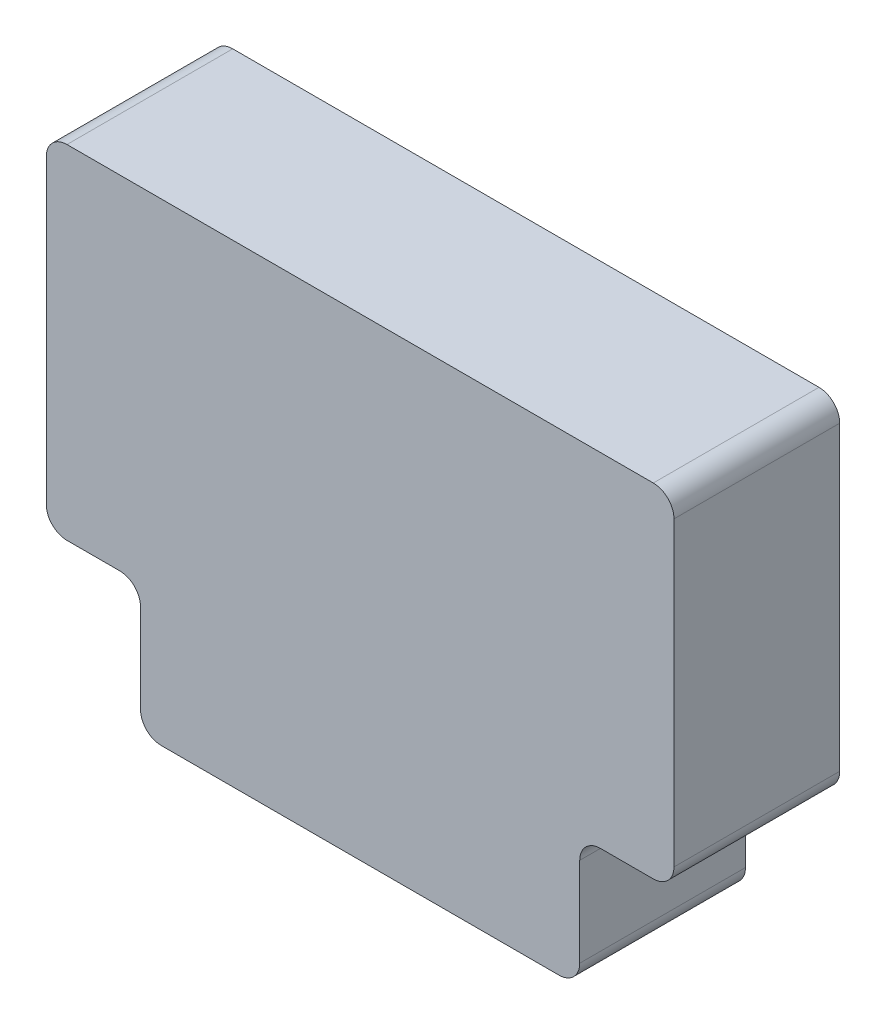
from build123d import *

# Parameters (mm, degrees)
DODANIE_WYCI_GNI_CIE1_DEPTH = 29
DODANIE_WYCI_GNI_CIE2_DEPTH = 3
SZKIC3_R                    = 3
SZKIC3_R_2                  = 1.5
DODANIE_WYCI_GNI_CIE3_DEPTH = 22
SZKIC5_W                    = 13
SZKIC5_H                    = 6
WYTNIJ_WYCI_GNI_CIE1_DEPTH  = 7
ZAOKR_GLENIE1_R             = 4
ZAOKR_GLENIE2_R             = 4


with BuildPart() as part:
    # Szkic1 → Dodanie-wyciągnięcie1 (new body)
    with BuildSketch(Plane.XY):
        Polygon((-1.456531899, 63.2), (118.2, 63.2), (118.2, -3), (100, -3), (100, -28.2), (15.2, -28.2), (15.2, -3), (-3, -3), (-3, 63.2), align=None)
        Polygon((0, 0), (0, 60.2), (115.2, 60.2), (115.2, 0), (97, 0), (97, -25.2), (18.2, -25.2), (18.2, 0), align=None, mode=Mode.SUBTRACT)
    extrude(amount=DODANIE_WYCI_GNI_CIE1_DEPTH)

    # Szkic2 → Dodanie-wyciągnięcie2 (add)
    with BuildSketch(Plane.XY.offset(29)):
        Polygon((-3, 63.2), (-3, -3), (15.2, -3), (15.2, -28.2), (100, -28.2), (100, -3), (118.2, -3), (118.2, 63.2), align=None)
    extrude(amount=DODANIE_WYCI_GNI_CIE2_DEPTH)

    # Szkic3 → Dodanie-wyciągnięcie3 (add)
    # profile 1 of 4: a face of its own
    with BuildSketch(Plane(origin=(0, 0, 29), x_dir=(-1, 0, 0), z_dir=(0, 0, -1))):
        with Locations(Location((-111.2, 4, 0), (0, 0, 180))):
            Circle(SZKIC3_R)
        with Locations((-111.2, 4)):
            Circle(SZKIC3_R_2, mode=Mode.SUBTRACT)
    # profile 2 of 4: a face of its own
    with BuildSketch(Plane(origin=(0, 0, 29), x_dir=(-1, 0, 0), z_dir=(0, 0, -1))):
        with Locations(Location((-111.2, 56.2, 0), (0, 0, 180))):
            Circle(SZKIC3_R)
        with Locations((-111.2, 56.2)):
            Circle(SZKIC3_R_2, mode=Mode.SUBTRACT)
    # profile 3 of 4: a face of its own
    with BuildSketch(Plane(origin=(0, 0, 29), x_dir=(-1, 0, 0), z_dir=(0, 0, -1))):
        with Locations(Location((-3.901278793, 56.103657268, 0), (0, 0, 180))):
            Circle(SZKIC3_R)
        with Locations((-3.901278793, 56.103657268)):
            Circle(SZKIC3_R_2, mode=Mode.SUBTRACT)
    # profile 4 of 4: a face of its own
    with BuildSketch(Plane(origin=(0, 0, 29), x_dir=(-1, 0, 0), z_dir=(0, 0, -1))):
        with Locations(Location((-4.096342732, 3.901278793, 0), (0, 0, 180))):
            Circle(SZKIC3_R)
        with Locations((-4.096342732, 3.901278793)):
            Circle(SZKIC3_R_2, mode=Mode.SUBTRACT)
    extrude(amount=DODANIE_WYCI_GNI_CIE3_DEPTH)

    # Szkic5 → Wytnij-wyciągnięcie1 (cut)
    with BuildSketch(Plane(origin=(0, 0, 0), x_dir=(-1, 0, 0), z_dir=(0, 0, -1))):
        with Locations((-57.6, -25.2)):
            Rectangle(SZKIC5_W, SZKIC5_H)
    extrude(amount=-WYTNIJ_WYCI_GNI_CIE1_DEPTH, mode=Mode.SUBTRACT)

    # Zaokrąglenie1
    zaokr_glenie1_edges = [part.edges().sort_by_distance(p)[0] for p in [
        (118.2, 63.2, 16),
        (118.2, -3, 16),
        (100, -28.2, 16),
        (15.2, -28.2, 16),
        (-3, -3, 16),
        (-3, 63.2, 16),
    ]]
    fillet(zaokr_glenie1_edges, radius=ZAOKR_GLENIE1_R)

    # Zaokrąglenie2
    zaokr_glenie2_edges = [part.edges().sort_by_distance(p)[0] for p in [
        (100, -3, 16),
        (15.2, -3, 16),
    ]]
    fillet(zaokr_glenie2_edges, radius=ZAOKR_GLENIE2_R)


solid = part.part
